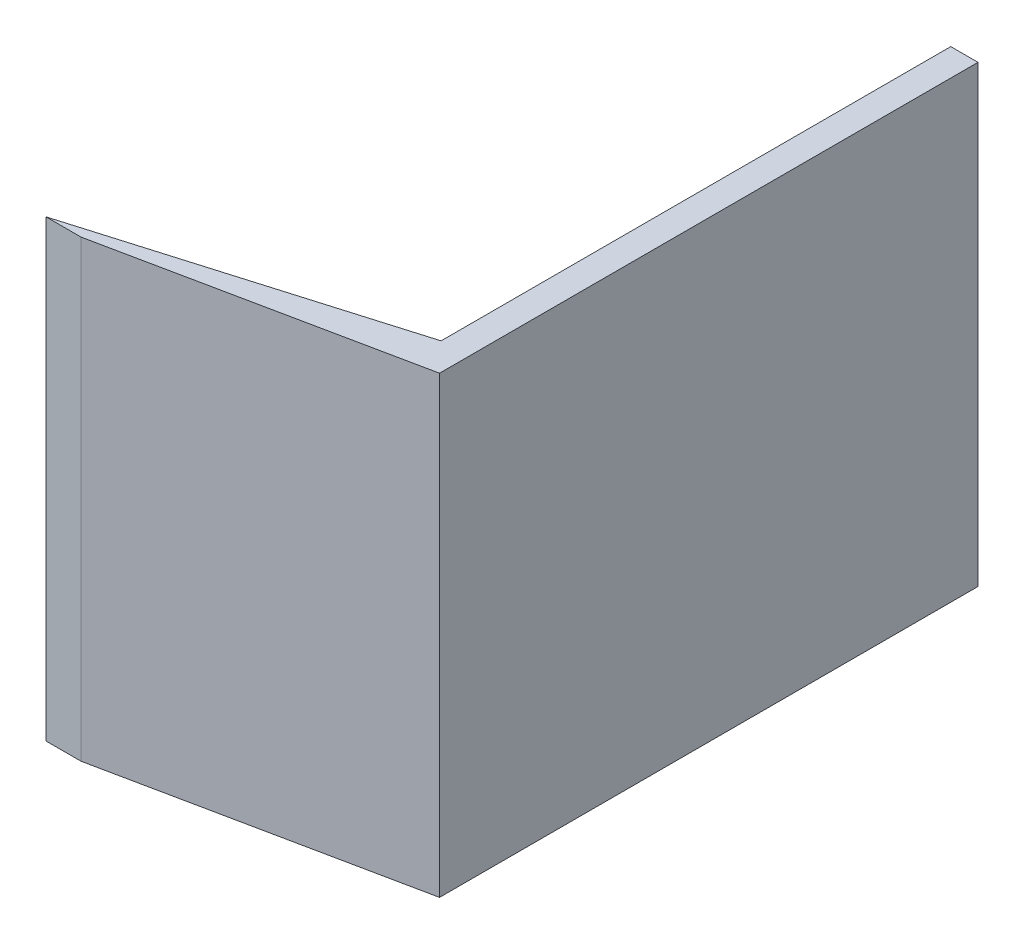
from build123d import *

# Parameters (mm, degrees)
BOSS_EXTRUDE1_DEPTH = 50


with BuildPart() as part:
    # Sketch1 → Boss-Extrude1 (new body)
    with BuildSketch(Plane(origin=(0, 0, 0), x_dir=(1, 0, 0), z_dir=(0, 1, 0))):
        Polygon((3, 46.72), (0, 46.72), (0, 0), (0.000186337, -0.03343628), (3, 0), align=None)
        Polygon((3, 0), (0.000186337, -0.03343628), (0.000186337, -9.413789645), (-8.16140534, -11.826136958), (-33.586790943, -19.341198123), (-29.724787296, -19.341198123), (-7.554025616, -14.764008615), (3, -12.585113004), align=None)
    extrude(amount=BOSS_EXTRUDE1_DEPTH)


solid = part.part
